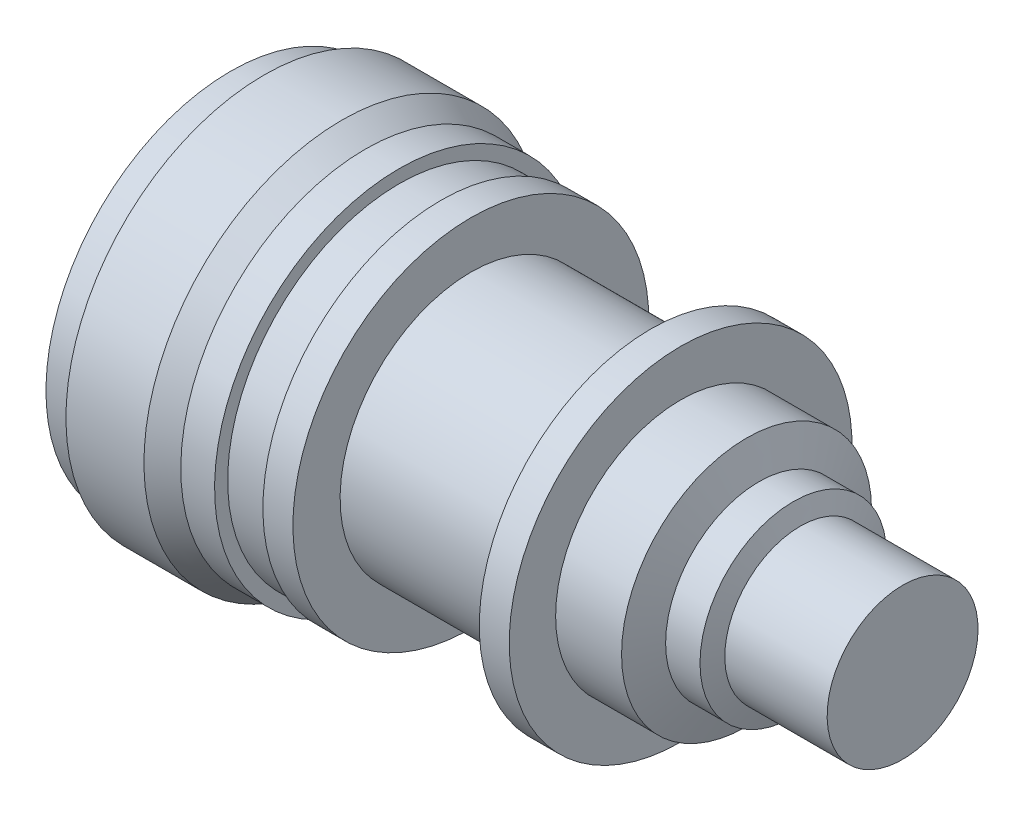
from build123d import *


with BuildPart() as part:
    # Sketch2 → Revolve2 (revolve)
    with BuildSketch(Plane.XY):
        Polygon((187.727597645, 102.741789212), (187.727597645, 114.028703533), (189.775445954, 114.028703533), (189.775445954, 114.854982346), (194.54787846, 114.854982346), (195.975850391, 114.028703533), (198.04265187, 114.028703533), (198.04265187, 113.227772851), (200.597970063, 113.227772851), (200.597970063, 113.628238192), (202.434218655, 113.628238192), (202.434218655, 110.741789212), (213.434218655, 110.741789212), (213.434218655, 113.227772851), (215.265727926, 113.227772851), (215.265727926, 110.388873813), (219.299066117, 110.388873813), (220.055017887, 108.449693185), (222.158535856, 108.449693185), (222.584256133, 107.357628126), (228.843550949, 107.357628126), (228.843550949, 102.741789212), align=None)
    revolve(axis=Axis((241.707962768, 102.741789212, 0), (-1, 0, 0)))


solid = part.part
